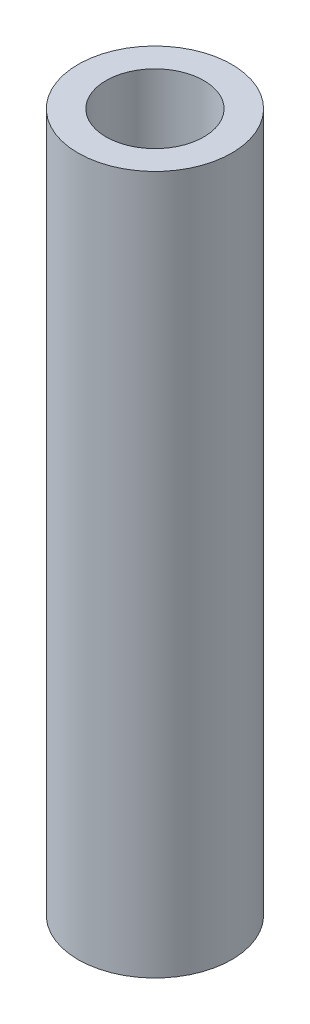
from build123d import *

# Parameters (mm, degrees)
IZIM1_R                     = 2.75
IZIM1_R_2                   = 1.75
Y_KSEKLIK_EKSTR_ZYON1_DEPTH = 25


with BuildPart() as part:
    # Çizim1 → Yükseklik-Ekstrüzyon1 (new body)
    with BuildSketch(Plane(origin=(0, 0, 0), x_dir=(1, 0, 0), z_dir=(0, 1, 0))):
        with Locations(Location((0, 0, 0), (0, 0, 270))):
            Circle(IZIM1_R)
        with Locations(Location((0, 0, 0), (0, 0, 270))):
            Circle(IZIM1_R_2, mode=Mode.SUBTRACT)
    extrude(amount=Y_KSEKLIK_EKSTR_ZYON1_DEPTH)


solid = part.part
